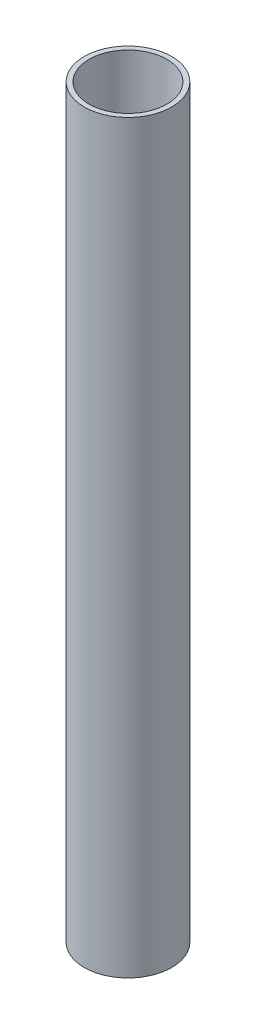
from build123d import *

# Parameters (mm, degrees)
SKETCH1_R           = 57.15
SKETCH1_R_2         = 50.8
BOSS_EXTRUDE1_DEPTH = 486.664


with BuildPart() as part:
    # Sketch1 → Boss-Extrude1 (new, symmetric)
    with BuildSketch(Plane(origin=(0, 0, 0), x_dir=(1, 0, 0), z_dir=(0, 1, 0))):
        with Locations(Location((0, 0, 0), (0, 0, 270))):
            Circle(SKETCH1_R)
        with Locations(Location((0, 0, 0), (0, 0, 270))):
            Circle(SKETCH1_R_2, mode=Mode.SUBTRACT)
    extrude(amount=BOSS_EXTRUDE1_DEPTH, both=True)


solid = part.part
